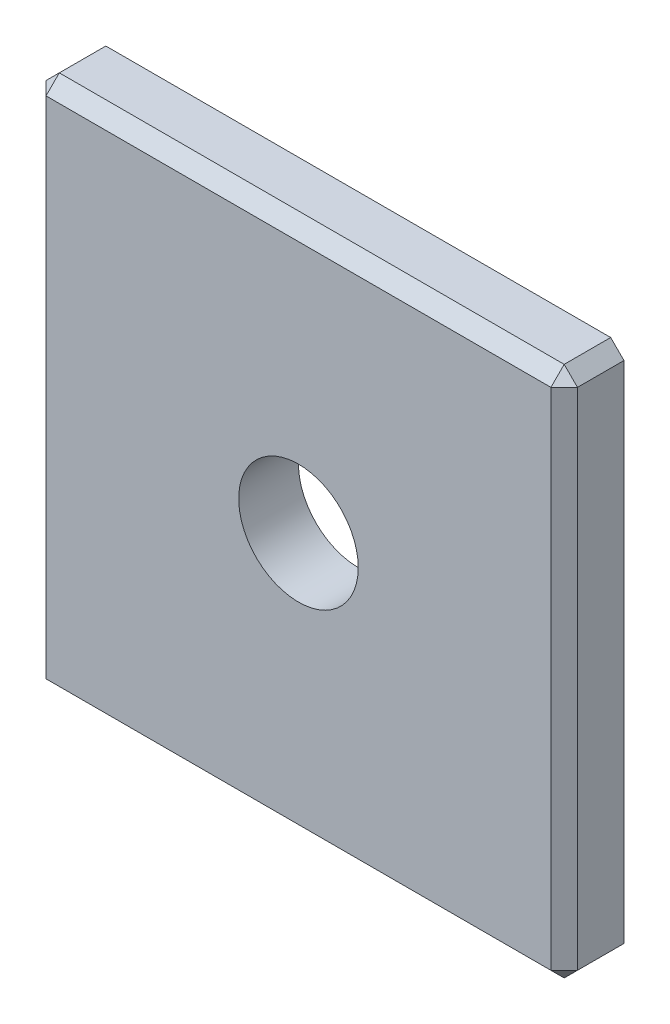
from build123d import *

# Parameters (mm, degrees)
CROQUIS1_W              = 40
CROQUIS1_H              = 40
CROQUIS1_R              = 4.5
SALIENTE_EXTRUIR1_DEPTH = 4.5
CHAFL_N1_SIZE           = 1


with BuildPart() as part:
    # Croquis1 → Saliente-Extruir1 (new body)
    with BuildSketch(Plane.XY):
        Rectangle(CROQUIS1_W, CROQUIS1_H)
        Circle(CROQUIS1_R, mode=Mode.SUBTRACT)
    extrude(amount=SALIENTE_EXTRUIR1_DEPTH)

    # Chaflán1
    chafl_n1_edges = [part.edges().sort_by_distance(p)[0] for p in [
        (-20, 0, 4.5),
        (0, -20, 4.5),
        (20, 0, 4.5),
        (20, -20, 2.25),
        (-20, -20, 2.25),
        (-20, 20, 2.25),
        (20, 20, 2.25),
        (0, 20, 4.5),
    ]]
    chamfer(chafl_n1_edges, length=CHAFL_N1_SIZE)


solid = part.part
